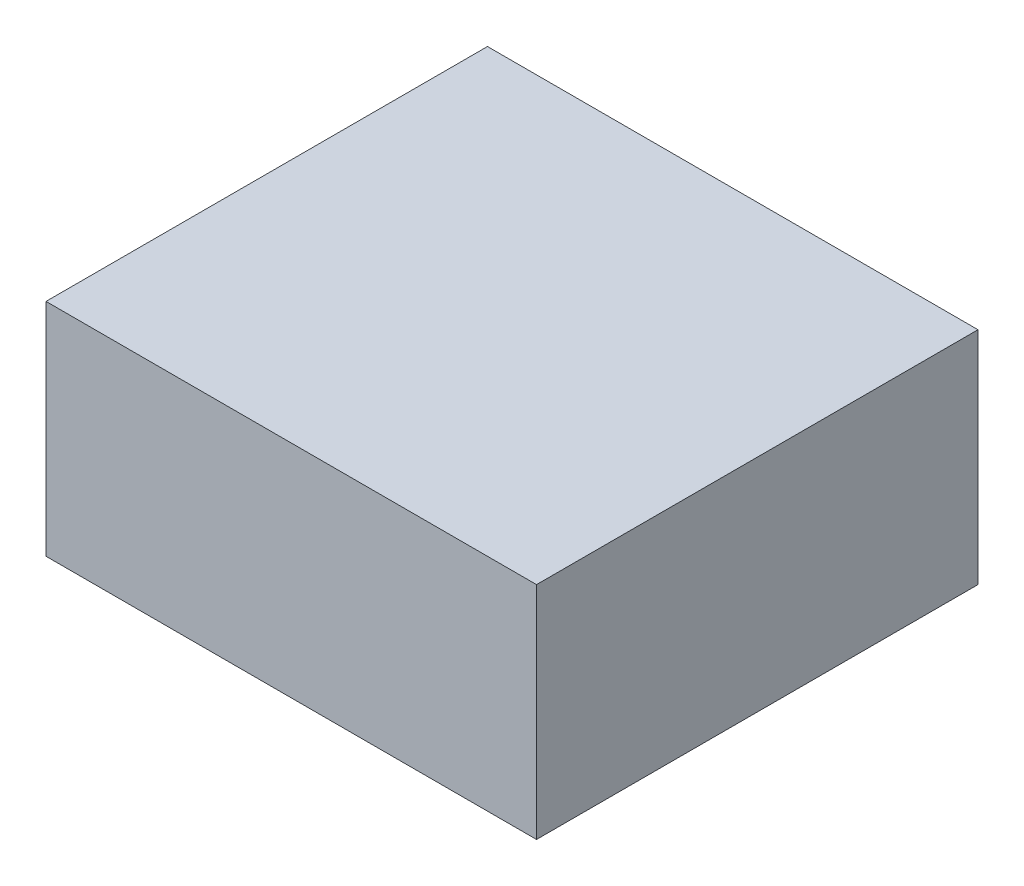
from build123d import *

# Parameters (mm, degrees)
SKETCH_1_W      = 100
SKETCH_1_H      = 45
EXTRUDE_1_DEPTH = 90


with BuildPart() as part:
    # 草圖1 → 填料-伸長1 (new body)
    with BuildSketch(Plane.XY):
        with Locations((-41.382225914, 19.395)):
            Rectangle(SKETCH_1_W, SKETCH_1_H)
    extrude(amount=EXTRUDE_1_DEPTH)


solid = part.part
